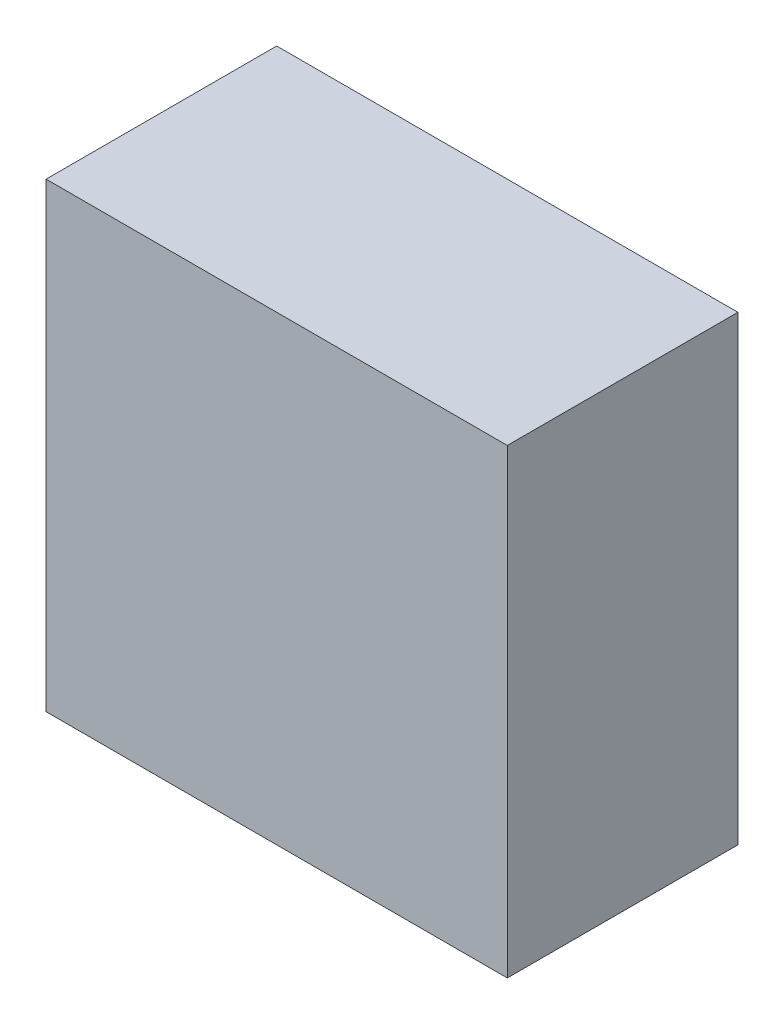
from build123d import *

# Parameters (mm, degrees)
SKETCH1_W           = 20
SKETCH1_H           = 20
BOSS_EXTRUDE1_DEPTH = 10


with BuildPart() as part:
    # Sketch1 → Boss-Extrude1 (new body)
    with BuildSketch(Plane.XY):
        with Locations((20, 20)):
            Rectangle(SKETCH1_W, SKETCH1_H)
    extrude(amount=BOSS_EXTRUDE1_DEPTH)


solid = part.part
